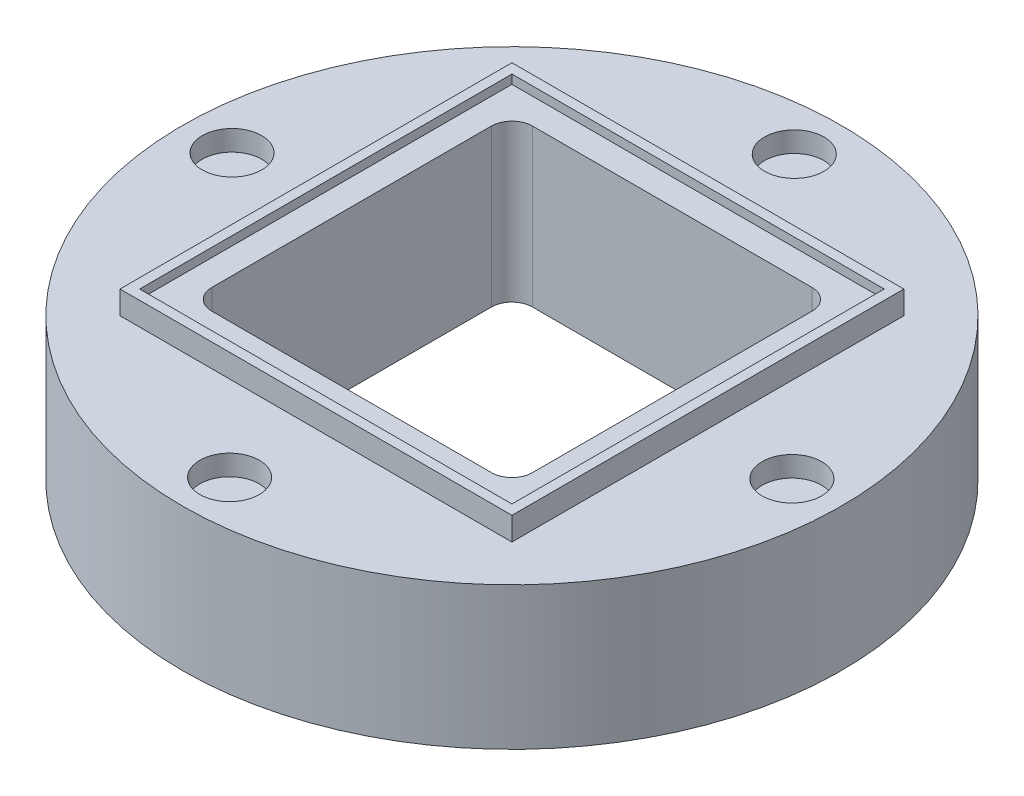
from build123d import *

# Parameters (mm, degrees)
SKETCH1_R           = 18.5
BOSS_EXTRUDE1_DEPTH = 8
SKETCH11_R          = 1.67
CUT_EXTRUDE5_DEPTH  = 1.15
CIRPATTERN1_COUNT   = 4
SKETCH13_W          = 22
SKETCH13_H          = 22
SKETCH13_W_2        = 20.9
SKETCH13_H_2        = 20.9
BOSS_EXTRUDE3_DEPTH = 1.3
SKETCH12_W          = 22
SKETCH12_H          = 22
BOSS_EXTRUDE2_DEPTH = 0.8
CUT_EXTRUDE6_DEPTH  = 28.603260677


with BuildPart() as part:
    # Sketch1 → Boss-Extrude1 (new body)
    with BuildSketch(Plane(origin=(0, 0, 0), x_dir=(1, 0, 0), z_dir=(0, 1, 0))):
        with Locations(Location((0, 0, 0), (0, 0, 270))):
            Circle(SKETCH1_R)
    extrude(amount=BOSS_EXTRUDE1_DEPTH)

    # Sketch11 → Cut-Extrude5 (cut)
    with BuildSketch(Plane(origin=(0, 8, 0), x_dir=(1, 0, 0), z_dir=(0, 1, 0))):
        with Locations(Location((0.066774753, 15.781335524, 0), (0, 0, 270))):
            Circle(SKETCH11_R)
    cut_extrude5 = extrude(amount=-CUT_EXTRUDE5_DEPTH, mode=Mode.SUBTRACT)

    # CirPattern1: Cut-Extrude5 ×4 about axis
    cirpattern1_axis = Axis((0, 0, 0), (0, 1, 0))
    for i in range(1, CIRPATTERN1_COUNT):
        add(cut_extrude5.rotate(cirpattern1_axis, i * 360 / CIRPATTERN1_COUNT), mode=Mode.SUBTRACT)

    # Sketch13 → Boss-Extrude3 (add)
    with BuildSketch(Plane(origin=(0, 8, 0), x_dir=(1, 0, 0), z_dir=(0, 1, 0))):
        Rectangle(SKETCH13_W, SKETCH13_H)
        Rectangle(SKETCH13_W_2, SKETCH13_H_2, mode=Mode.SUBTRACT)
    extrude(amount=BOSS_EXTRUDE3_DEPTH)

    # Sketch12 → Boss-Extrude2 (add)
    with BuildSketch(Plane(origin=(0, 8, 0), x_dir=(1, 0, 0), z_dir=(0, 1, 0))):
        Rectangle(SKETCH12_W, SKETCH12_H)
    extrude(amount=BOSS_EXTRUDE2_DEPTH)

    # Sketch14 → Cut-Extrude6 (cut, through all)
    with BuildSketch(Plane(origin=(0, 8.8, 0), x_dir=(1, 0, 0), z_dir=(0, 1, 0))):
        with BuildLine():
            ThreePointArc((-9, -7.85), (-8.663172798, -8.663172798), (-7.85, -9))
            Line((-7.85, -9), (7.85, -9))
            ThreePointArc((7.85, -9), (8.663172798, -8.663172798), (9, -7.85))
            Line((9, -7.85), (9, 7.85))
            ThreePointArc((9, 7.85), (8.663172798, 8.663172798), (7.85, 9))
            Line((7.85, 9), (-7.85, 9))
            ThreePointArc((-7.85, 9), (-8.663172798, 8.663172798), (-9, 7.85))
            Line((-9, 7.85), (-9, -7.85))
        make_face()
    extrude(amount=-CUT_EXTRUDE6_DEPTH, mode=Mode.SUBTRACT)


solid = part.part
